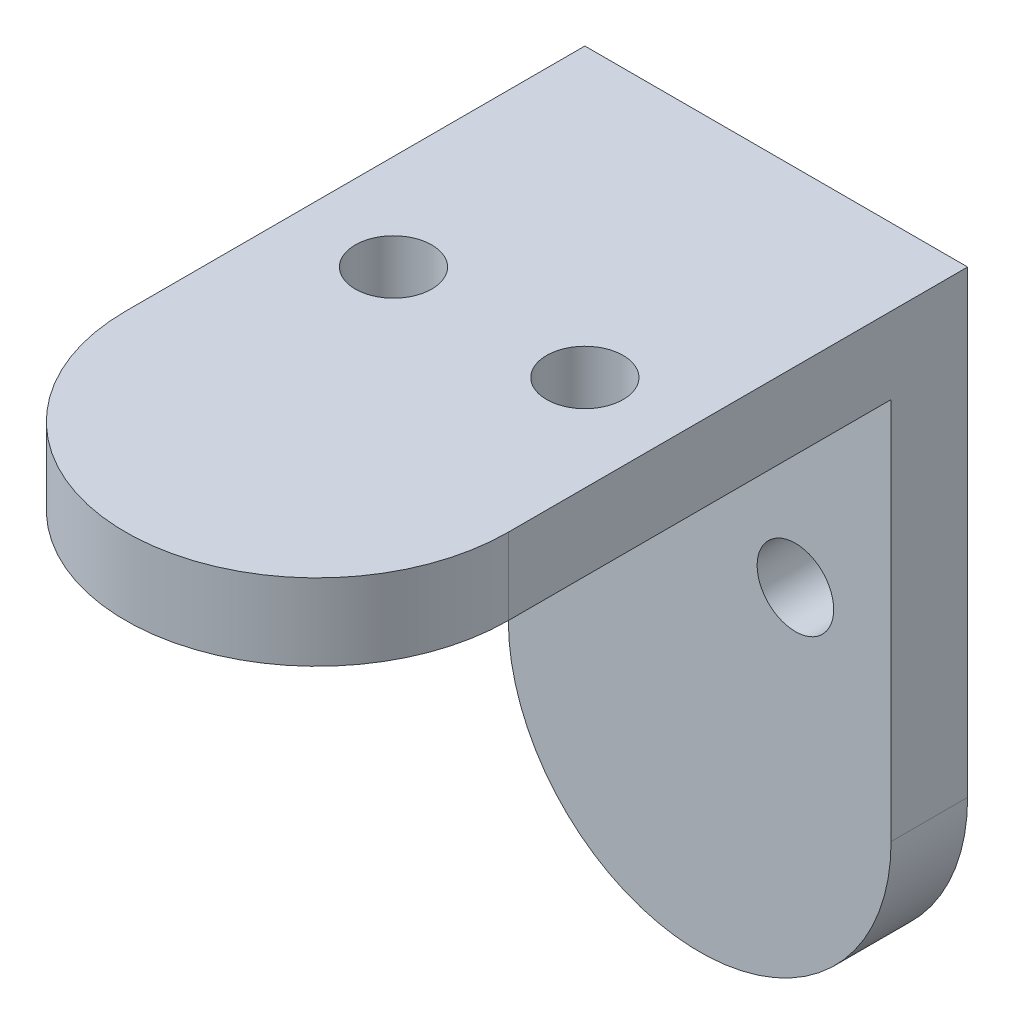
from build123d import *

# Parameters (mm, degrees)
EXTRUDE_1_DEPTH     = 8
EXTRUDE_2_DEPTH     = 8
CUT_EXTRUDE_1_REACH = 83.388
SKETCH_3_R          = 4
CUT_EXTRUDE_2_REACH = 100.224
SKETCH_4_R          = 4


with BuildPart() as part:
    # 草图1 → 凸台-拉伸1 (new body)
    with BuildSketch(Plane.XY):
        with BuildLine():
            Line((-20, 20), (20, 20))
            Line((20, 20), (20, -20))
            ThreePointArc((20, -20), (0, -40), (-20, -20))
            Line((-20, -20), (-20, 20))
        make_face()
    extrude(amount=EXTRUDE_1_DEPTH)

    # 草图2 → 凸台-拉伸2 (add)
    with BuildSketch(Plane(origin=(0, 20, 0), x_dir=(1, 0, 0), z_dir=(0, 1, 0))):
        with BuildLine():
            Line((-20, 0), (20, 0))
            Line((20, 0), (20, -48))
            ThreePointArc((20, -48), (0, -68), (-20, -48))
            Line((-20, -48), (-20, 0))
        make_face()
    extrude(amount=EXTRUDE_2_DEPTH)

    # 草图3 → 切除-拉伸1 (cut, up to next)
    with BuildSketch(Plane(origin=(0, 0, 0), x_dir=(-1, 0, 0), z_dir=(0, 0, -1)), mode=Mode.PRIVATE) as cut_extrude_1_sk1:
        with Locations((-10, -2)):
            Circle(SKETCH_3_R)
    cut_extrude_1_tool1 = extrude(cut_extrude_1_sk1.sketch, amount=-CUT_EXTRUDE_1_REACH, mode=Mode.PRIVATE) & part.part
    # 草图3 → 切除-拉伸1 (cut, up to next)
    with BuildSketch(Plane(origin=(0, 0, 0), x_dir=(-1, 0, 0), z_dir=(0, 0, -1)), mode=Mode.PRIVATE) as cut_extrude_1_sk2:
        with Locations((10, -2)):
            Circle(SKETCH_3_R)
    cut_extrude_1_tool2 = extrude(cut_extrude_1_sk2.sketch, amount=-CUT_EXTRUDE_1_REACH, mode=Mode.PRIVATE) & part.part
    add(cut_extrude_1_tool1.solids().sort_by_distance((10, -2, 0))[0], mode=Mode.SUBTRACT)
    add(cut_extrude_1_tool2.solids().sort_by_distance((-10, -2, 0))[0], mode=Mode.SUBTRACT)

    # 草图4 → 切除-拉伸2 (cut, up to next)
    with BuildSketch(Plane(origin=(0, 28, 0), x_dir=(1, 0, 0), z_dir=(0, 1, 0)), mode=Mode.PRIVATE) as cut_extrude_2_sk1:
        with Locations(Location((-10, -30, 0), (0, 0, 270))):
            Circle(SKETCH_4_R)
    cut_extrude_2_tool1 = extrude(cut_extrude_2_sk1.sketch, amount=-CUT_EXTRUDE_2_REACH, mode=Mode.PRIVATE) & part.part
    # 草图4 → 切除-拉伸2 (cut, up to next)
    with BuildSketch(Plane(origin=(0, 28, 0), x_dir=(1, 0, 0), z_dir=(0, 1, 0)), mode=Mode.PRIVATE) as cut_extrude_2_sk2:
        with Locations(Location((10, -30, 0), (0, 0, 270))):
            Circle(SKETCH_4_R)
    cut_extrude_2_tool2 = extrude(cut_extrude_2_sk2.sketch, amount=-CUT_EXTRUDE_2_REACH, mode=Mode.PRIVATE) & part.part
    add(cut_extrude_2_tool1.solids().sort_by_distance((-10, 28, 30))[0], mode=Mode.SUBTRACT)
    add(cut_extrude_2_tool2.solids().sort_by_distance((10, 28, 30))[0], mode=Mode.SUBTRACT)


solid = part.part
